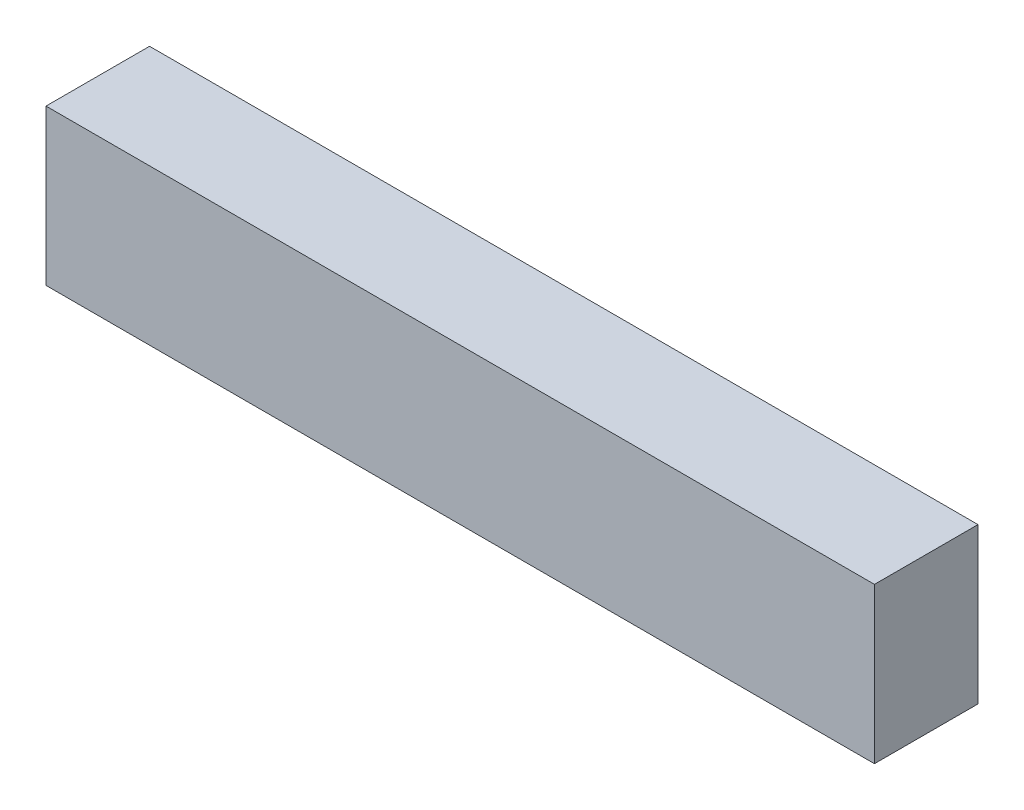
from build123d import *

# Parameters (mm, degrees)
SKETCH_1_W      = 8
SKETCH_1_H      = 1.5
EXTRUDE_1_DEPTH = 1


with BuildPart() as part:
    # 草图1 → 凸台-拉伸1 (new body)
    with BuildSketch(Plane.XY):
        Rectangle(SKETCH_1_W, SKETCH_1_H)
    extrude(amount=EXTRUDE_1_DEPTH)


solid = part.part
